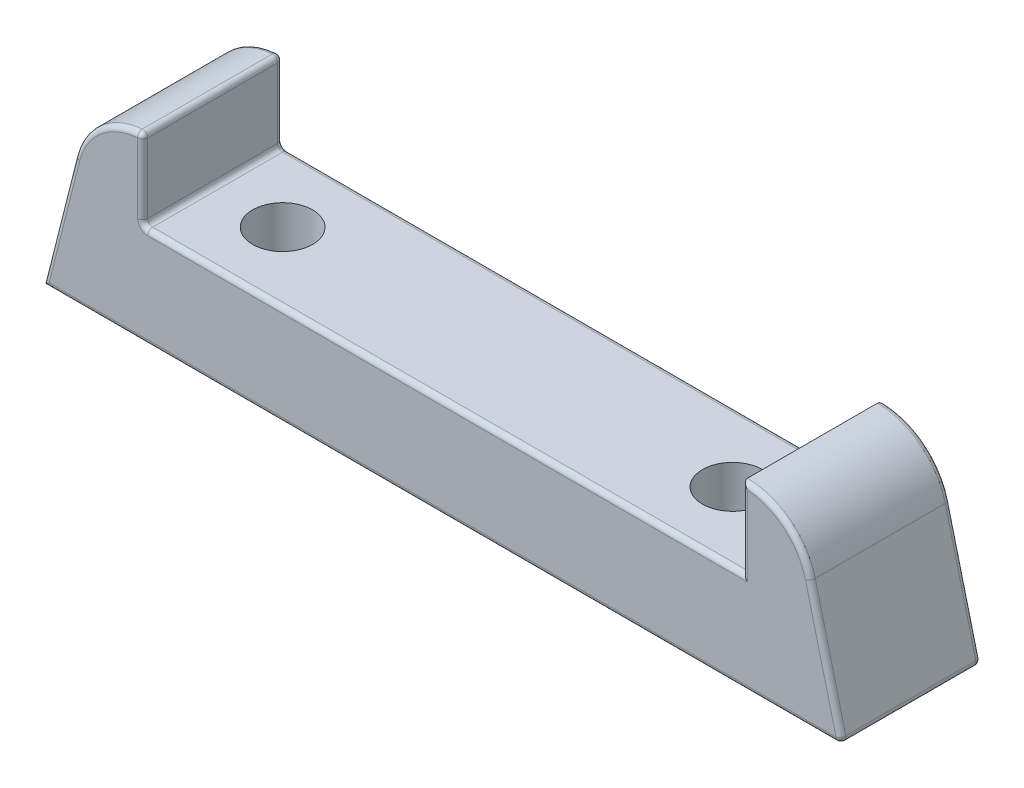
from build123d import *

# Parameters (mm, degrees)
BOSS_EXTRUDE1_DEPTH = 7
SKETCH2_R           = 3
CUT_EXTRUDE1_DEPTH  = 14
FILLET1_R           = 0.5


with BuildPart() as part:
    # Sketch1 → Boss-Extrude1 (new, symmetric)
    with BuildSketch(Plane.XY):
        with BuildLine():
            Line((-40, 0), (40, 0))
            Line((40, 0), (36.78663137, 12.715119427))
            ThreePointArc((36.78663137, 12.715119427), (34.30082341, 16.522944685), (30, 18))
            Line((30, 18), (30, 10))
            Line((30, 10), (-30, 10))
            Line((-30, 10), (-30, 18))
            ThreePointArc((-30, 18), (-34.30082341, 16.522944685), (-36.78663137, 12.715119427))
            Line((-36.78663137, 12.715119427), (-40, 0))
        make_face()
    extrude(amount=BOSS_EXTRUDE1_DEPTH, both=True)

    # Sketch2 → Cut-Extrude1 (cut)
    with BuildSketch(Plane(origin=(0, 10, 0), x_dir=(1, 0, 0), z_dir=(0, 1, 0))):
        with Locations(Location((-23, 0, 0), (0, 0, 270))):
            Circle(SKETCH2_R)
        with Locations(Location((22, 0, 0), (0, 0, 270))):
            Circle(SKETCH2_R)
    extrude(amount=-CUT_EXTRUDE1_DEPTH, mode=Mode.SUBTRACT)

    # Fillet1
    fillet1_edges = [part.edges().sort_by_distance(p)[0] for p in [
        (34.30082341, 16.522944685, -7),
        (38.393315685, 6.357559714, -7),
        (0, 0, -7),
        (-38.393315685, 6.357559714, -7),
        (38.393315685, 6.357559714, 7),
        (-30, 18, 0),
        (-30, 10, 0),
        (40, 0, 0),
        (34.30082341, 16.522944685, 7),
        (30, 14, 7),
        (0, 10, 7),
        (-30, 14, 7),
        (-34.30082341, 16.522944685, 7),
        (-38.393315685, 6.357559714, 7),
        (-34.30082341, 16.522944685, -7),
        (0, 0, 7),
        (-30, 14, -7),
        (0, 10, -7),
        (30, 14, -7),
    ]]
    fillet(fillet1_edges, radius=FILLET1_R)


solid = part.part
